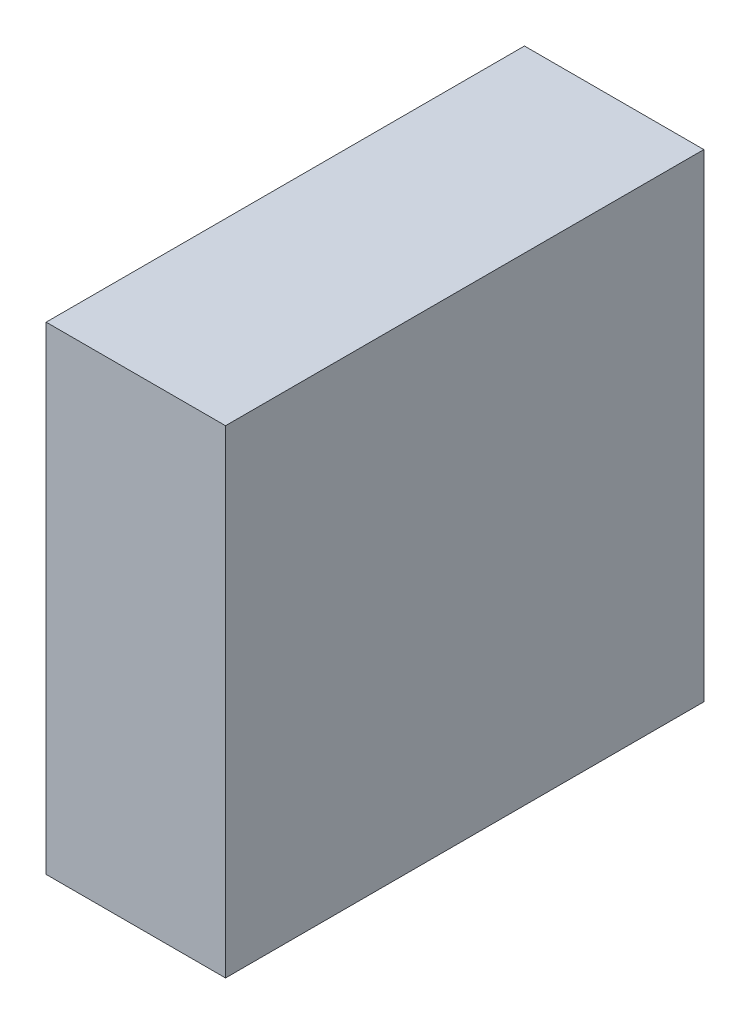
from build123d import *

# Parameters (mm, degrees)
SKETCH1_W           = 9.525
SKETCH1_H           = 25.4
BOSS_EXTRUDE1_DEPTH = 25.4
SKETCH4_R           = 1.5875
CUT_EXTRUDE1_DEPTH  = 9.525


with BuildPart() as part:
    # Sketch1 → Boss-Extrude1 (new body)
    with BuildSketch(Plane(origin=(0, 0, 0), x_dir=(1, 0, 0), z_dir=(0, 1, 0))):
        with Locations((4.7625, 12.7)):
            Rectangle(SKETCH1_W, SKETCH1_H)
    extrude(amount=BOSS_EXTRUDE1_DEPTH)

    # Sketch4 → Cut-Extrude1 (cut)
    with BuildSketch(Plane.XZ):
        with Locations(Location((4.7625, -19.05, 0), (0, 0, 270))):
            Circle(SKETCH4_R)
        with Locations(Location((4.7625, -6.35, 0), (0, 0, 270))):
            Circle(SKETCH4_R)
    extrude(amount=-CUT_EXTRUDE1_DEPTH, mode=Mode.SUBTRACT)


solid = part.part
